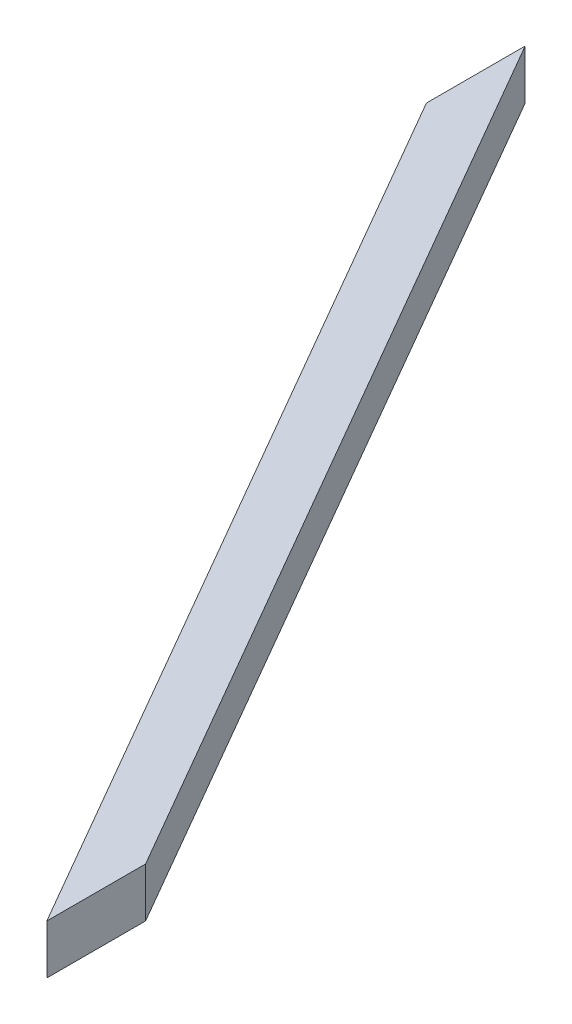
from build123d import *

# Parameters (mm, degrees)
EXTRUDE_1_DEPTH = 20


with BuildPart() as part:
    # 草图1 → 凸台-拉伸1 (new body)
    with BuildSketch(Plane(origin=(0, 0, 0), x_dir=(1, 0, 0), z_dir=(0, 1, 0))):
        Polygon((110, -603.730669589), (110, -563.730669589), (-100, -200), (-100, -240), align=None)
    extrude(amount=EXTRUDE_1_DEPTH)


solid = part.part
